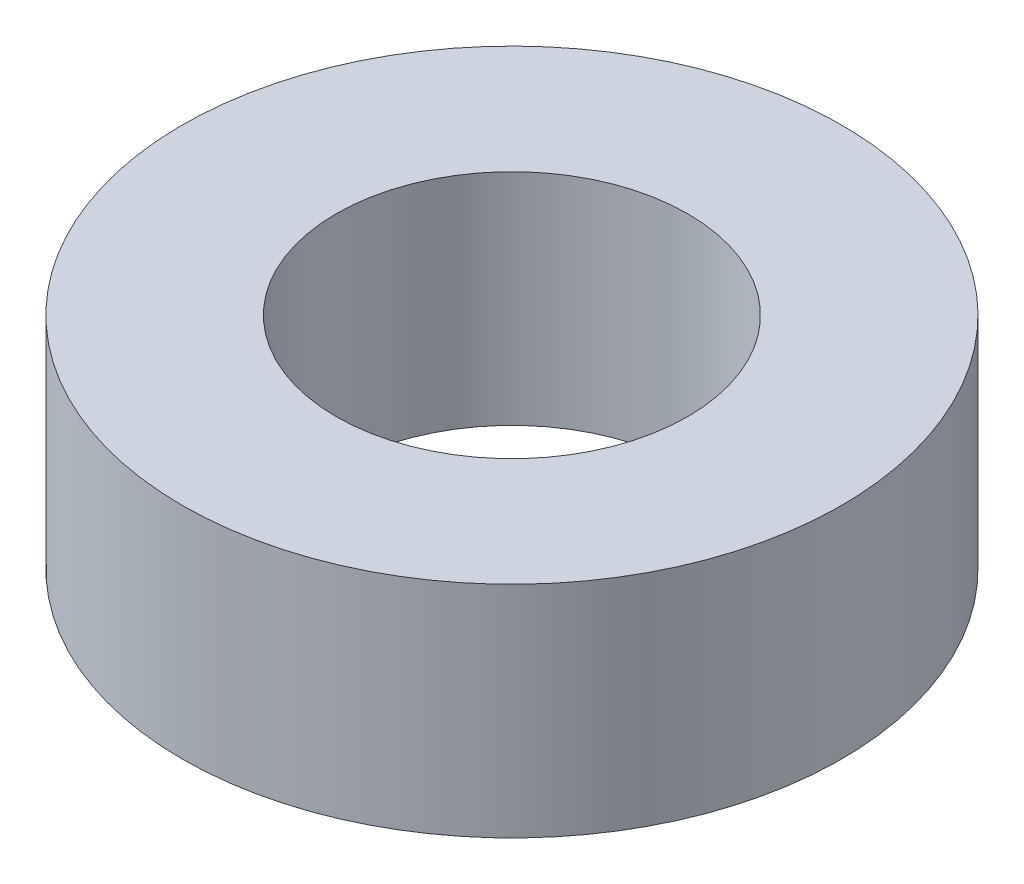
from build123d import *

# Parameters (mm, degrees)
SKETCH_1_R      = 3
SKETCH_1_R_2    = 1.6
EXTRUDE_1_DEPTH = 2


with BuildPart() as part:
    # ｽｹｯﾁ1 → ﾎﾞｽ - 押し出し1 (new body)
    with BuildSketch(Plane(origin=(0, 0, 0), x_dir=(1, 0, 0), z_dir=(0, 1, 0))):
        with Locations(Location((0, 0, 0), (0, 0, 270))):
            Circle(SKETCH_1_R)
        with Locations(Location((0, 0, 0), (0, 0, 270))):
            Circle(SKETCH_1_R_2, mode=Mode.SUBTRACT)
    extrude(amount=EXTRUDE_1_DEPTH)


solid = part.part
